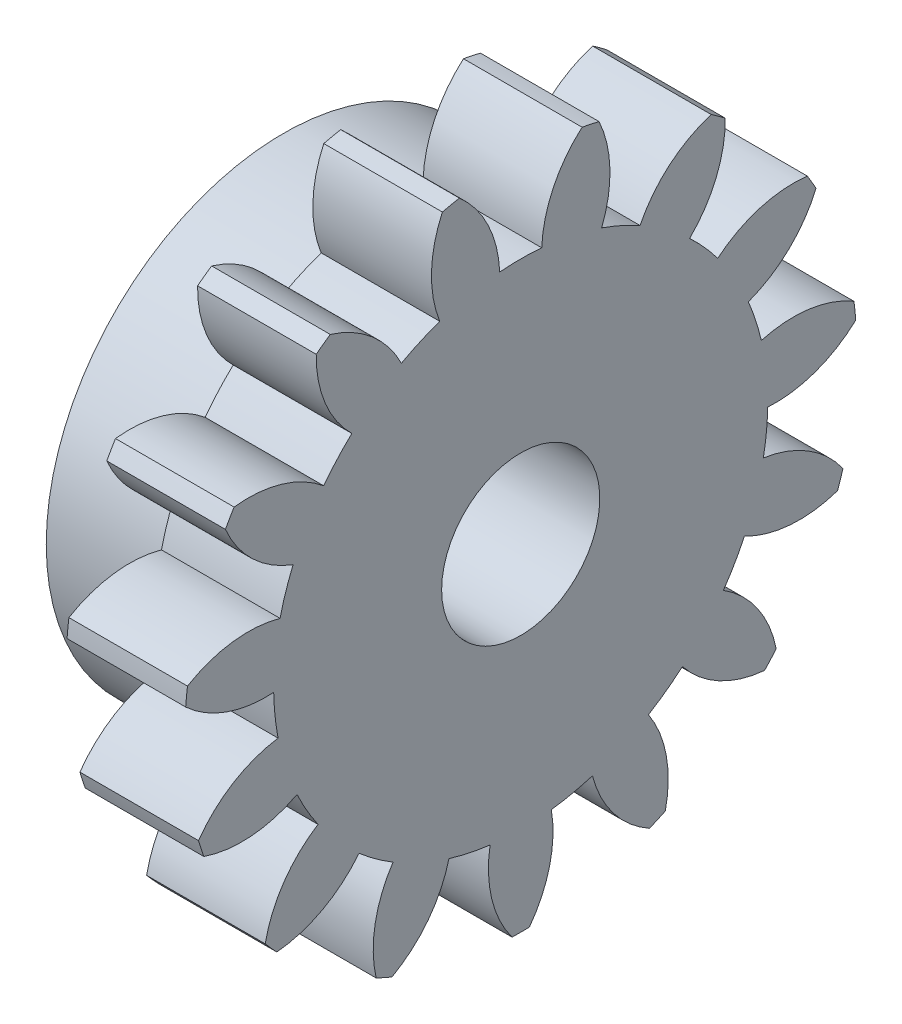
from build123d import *

# Parameters (mm, degrees)
BASPROSKE_W      = 3
BASPROSKE_H      = 8.5
TOOTHCUT_DEPTH   = 13.389511693
TEETHCUTS_COUNT  = 15
TEETHCUTS_ANGLE  = 336
HUBNEAONESKE_R   = 6
HUBNEARONE_DEPTH = 3.0000508
BORSKE_R         = 2
BORE_DEPTH       = 6.0000508


with BuildPart() as part:
    # BasProSke → Base-Revolve (revolve)
    with BuildSketch(Plane(origin=(0, 0, 0), x_dir=(1, 0, 0), z_dir=(0, 1, 0)), mode=Mode.PRIVATE) as base_revolve_sk:
        with Locations((1.5, 4.25)):
            Rectangle(BASPROSKE_W, BASPROSKE_H)
    revolve(base_revolve_sk.sketch.rotate(Axis((-10, 0, 0), (1, 0, 0)), 180), axis=Axis((-10, 0, 0), (1, 0, 0)))

    # TooCutSke → ToothCut (cut, through all)
    with BuildSketch(Plane(origin=(0, 0, 0), x_dir=(0, 0, -1), z_dir=(1, 0, 0))):
        with BuildLine():
            ThreePointArc((0.531576138, 6.226349477), (0, 6.249), (-0.531576138, 6.226349477))
            ThreePointArc((-0.531576138, 6.226349477), (-0.830301624, 7.411024729), (-1.576608494, 8.378350125))
            ThreePointArc((-1.576608494, 8.378350125), (0, 8.5254), (1.576608494, 8.378350125))
            ThreePointArc((1.576608494, 8.378350125), (0.830301624, 7.411024729), (0.531576138, 6.226349477))
        make_face()
    toothcut = extrude(amount=TOOTHCUT_DEPTH, mode=Mode.SUBTRACT)

    # TeethCuts: ToothCut ×15 about axis
    teethcuts_axis = Axis((-10, 0, 0), (1, 0, 0))
    for i in range(1, TEETHCUTS_COUNT):
        add(toothcut.rotate(teethcuts_axis, i * TEETHCUTS_ANGLE / (TEETHCUTS_COUNT - 1)), mode=Mode.SUBTRACT)

    # HubNeaOneSke → HubNearOne (add)
    with BuildSketch(Plane.ZY):
        with Locations(Location((0, 0, 0), (0, 0, 180))):
            Circle(HUBNEAONESKE_R)
    extrude(amount=HUBNEARONE_DEPTH)

    # BorSke → Bore (cut, symmetric)
    with BuildSketch(Plane(origin=(0, 0, 0), x_dir=(0, 0, -1), z_dir=(1, 0, 0))):
        with Locations(Location((0, 0, 0), (0, 0, 180))):
            Circle(BORSKE_R)
    extrude(amount=BORE_DEPTH, both=True, mode=Mode.SUBTRACT)


solid = part.part
